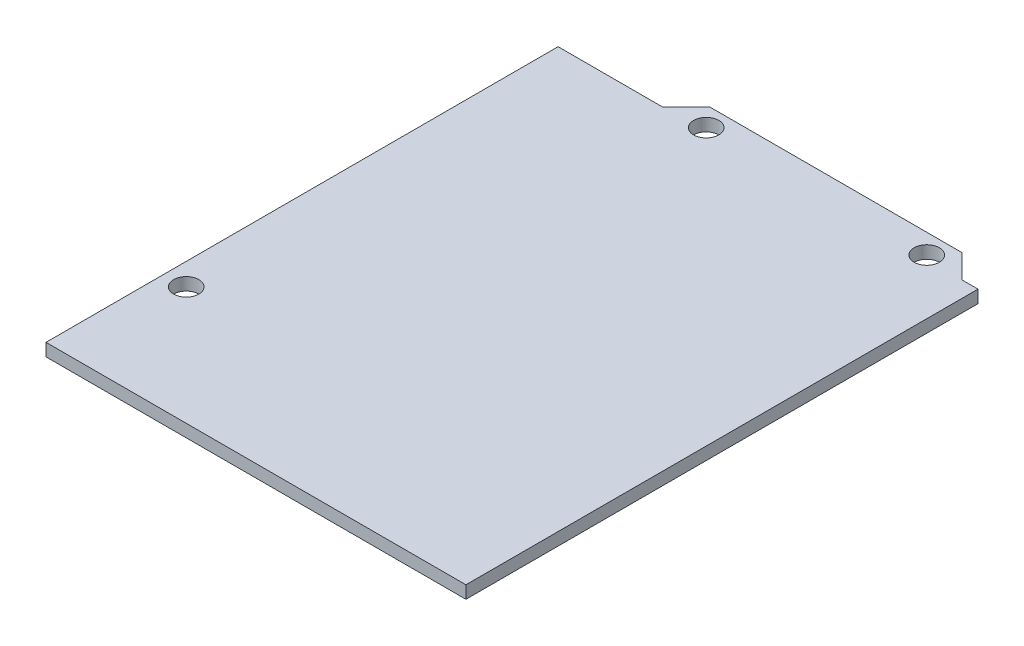
from build123d import *

# Parameters (mm, degrees)
BOSS_EXTRUDE1_DEPTH = 1.6
SKETCH2_R           = 1.6
CUT_EXTRUDE1_DEPTH  = 1.6


with BuildPart() as part:
    # Sketch1 → Boss-Extrude1 (new body)
    with BuildSketch(Plane(origin=(0, 0, 0), x_dir=(1, 0, 0), z_dir=(0, 1, 0))):
        Polygon((0, 0), (53.3, 0), (53.3, 65), (51.3, 65), (48.3, 68), (16.3, 68), (13.3, 65), (0, 65), align=None)
    extrude(amount=BOSS_EXTRUDE1_DEPTH)

    # Sketch2 → Cut-Extrude1 (cut)
    with BuildSketch(Plane(origin=(0, 1.6, 0), x_dir=(1, 0, 0), z_dir=(0, 1, 0))):
        with Locations(Location((18.3, 65.5, 0), (0, 0, 270))):
            Circle(SKETCH2_R)
        with Locations(Location((46.3, 65.5, 0), (0, 0, 270))):
            Circle(SKETCH2_R)
        with Locations(Location((2.8, 15, 0), (0, 0, 270))):
            Circle(SKETCH2_R)
    extrude(amount=-CUT_EXTRUDE1_DEPTH, mode=Mode.SUBTRACT)


solid = part.part
